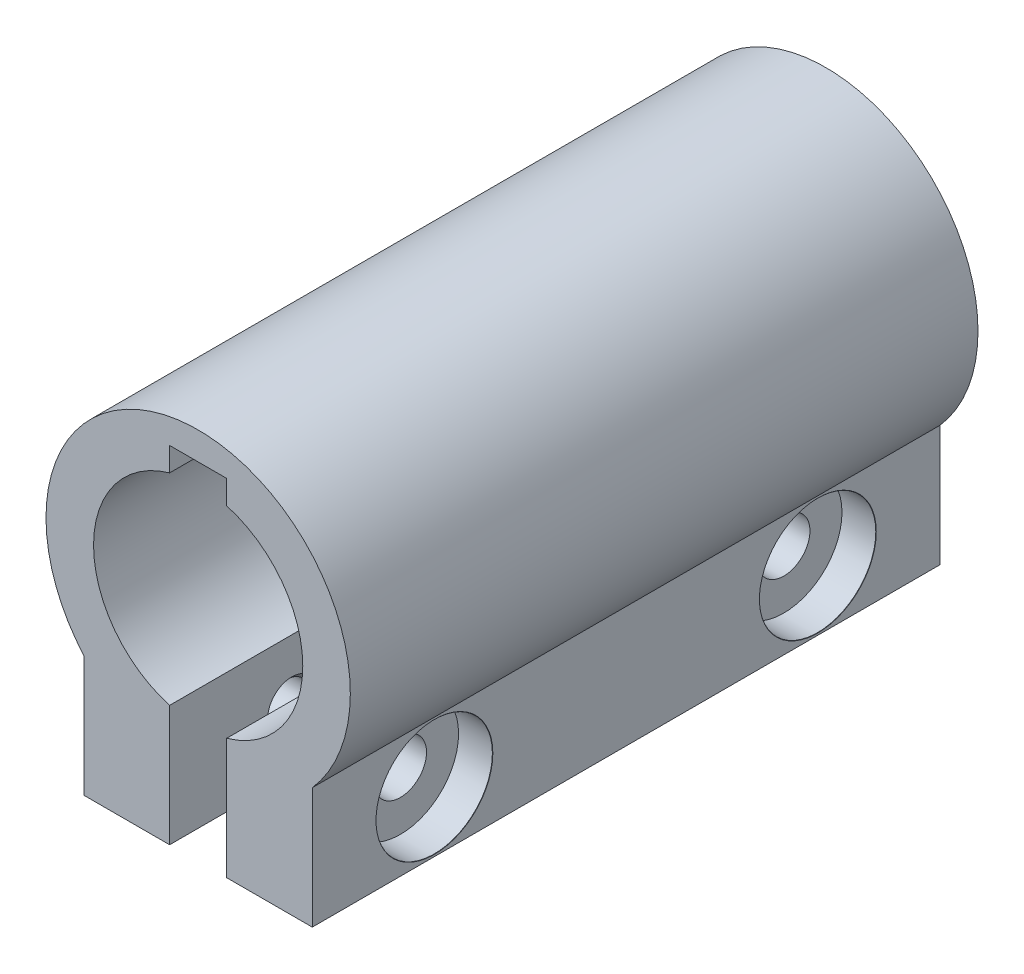
from build123d import *

# Parameters (mm, degrees)
BOSS_EXTRUDE1_DEPTH      = 33
BOSS_EXTRUDE1_DEPTH_BACK = 33
SKETCH1_R                = 16
SKETCH1_R_2              = 11
CUT_EXTRUDE1_DEPTH       = 33
BOSS_EXTRUDE2_DEPTH      = 66
CUT_EXTRUDE4_DEPTH       = 72.792049234


with BuildPart() as part:
    # Sketch1 → Boss-Extrude1 (new, two sides: drawn at the far end of the back side and taken through both)
    with BuildSketch(Plane.XY.offset(-BOSS_EXTRUDE1_DEPTH_BACK)):
        Circle(SKETCH1_R)
        Circle(SKETCH1_R_2, mode=Mode.SUBTRACT)
    extrude(amount=BOSS_EXTRUDE1_DEPTH + BOSS_EXTRUDE1_DEPTH_BACK)

    # Sketch2 → Cut-Extrude1 (cut)
    with BuildSketch(Plane.XY.offset(33)):
        Polygon((-3, 10.583005244), (-3, 13.083005244), (0, 13.083005244), (3, 13.083005244), (3, 10.583005244), align=None)
    cut_extrude1 = extrude(amount=-CUT_EXTRUDE1_DEPTH, mode=Mode.SUBTRACT)

    # Mirror2: Cut-Extrude1 across plane
    add(cut_extrude1.mirror(Plane(origin=(0, 0, 0), x_dir=(1, 0, 0), z_dir=(0, 0, -1))), mode=Mode.SUBTRACT)

    # Sketch3 → Boss-Extrude2 (add, through all)
    with BuildSketch(Plane.XY.offset(33)):
        with BuildLine():
            Line((-3, -23.283005244), (-3, -15.716233646))
            ThreePointArc((-3, -15.716233646), (-7.927011319, -13.898290958), (-12, -10.583005244))
            Line((-12, -10.583005244), (-12, -23.283005244))
            Line((-12, -23.283005244), (-3, -23.283005244))
        make_face()
        with BuildLine():
            ThreePointArc((12, -10.583005244), (7.927011319, -13.898290958), (3, -15.716233646))
            Line((3, -15.716233646), (3, -23.283005244))
            Line((3, -23.283005244), (12, -23.283005244))
            Line((12, -23.283005244), (12, -10.583005244))
        make_face()
    extrude(amount=-BOSS_EXTRUDE2_DEPTH)

    # Sketch4 → Cut-Extrude4 (cut, through all)
    with BuildSketch(Plane.XY.offset(33)):
        Polygon((-3, -10.583005244), (-3, -16.271539673), (3, -16.271539673), (3, -15.716233646), (3, -10.583005244), align=None)
    extrude(amount=-CUT_EXTRUDE4_DEPTH, mode=Mode.SUBTRACT)

    # Sketch10 → CBORE for M5 Hex Head Bolt3 (revolve, cut)
    with BuildSketch(Plane(origin=(12, -16.933005244, 20.158167141), x_dir=(0, 0, -1), z_dir=(0, 1, 0))):
        Polygon((0, 0), (0, 11.652366702), (2.75, 10), (2.75, 3.58), (6.12, 3.58), (6.12, 0.025), (6.145, 0), align=None)
    cbore_for_m5_hex_head_bolt3 = revolve(axis=Axis((18.35, -16.933005244, 20.158167141), (-1, 0, 0)), mode=Mode.SUBTRACT)

    # Mirror3: CBORE for M5 Hex Head Bolt3 across plane
    add(cbore_for_m5_hex_head_bolt3.mirror(Plane.XY), mode=Mode.SUBTRACT)

    # Sketch14 → M5x0.8 Tapped Hole1 (revolve, cut)
    with BuildSketch(Plane(origin=(-3, -16.933005244, 20.158167141), x_dir=(0, 0, -1), z_dir=(0, 1, 0))):
        Polygon((0, 0), (0, 13.6618073), (2.1, 12.4), (2.1, 0.425), (2.525, 0), align=None)
    m5x0_8_tapped_hole1 = revolve(axis=Axis((3.35, -16.933005244, 20.158167141), (-1, 0, 0)), mode=Mode.SUBTRACT)

    # Mirror4: M5x0.8 Tapped Hole1 across plane
    add(m5x0_8_tapped_hole1.mirror(Plane.XY), mode=Mode.SUBTRACT)


solid = part.part
